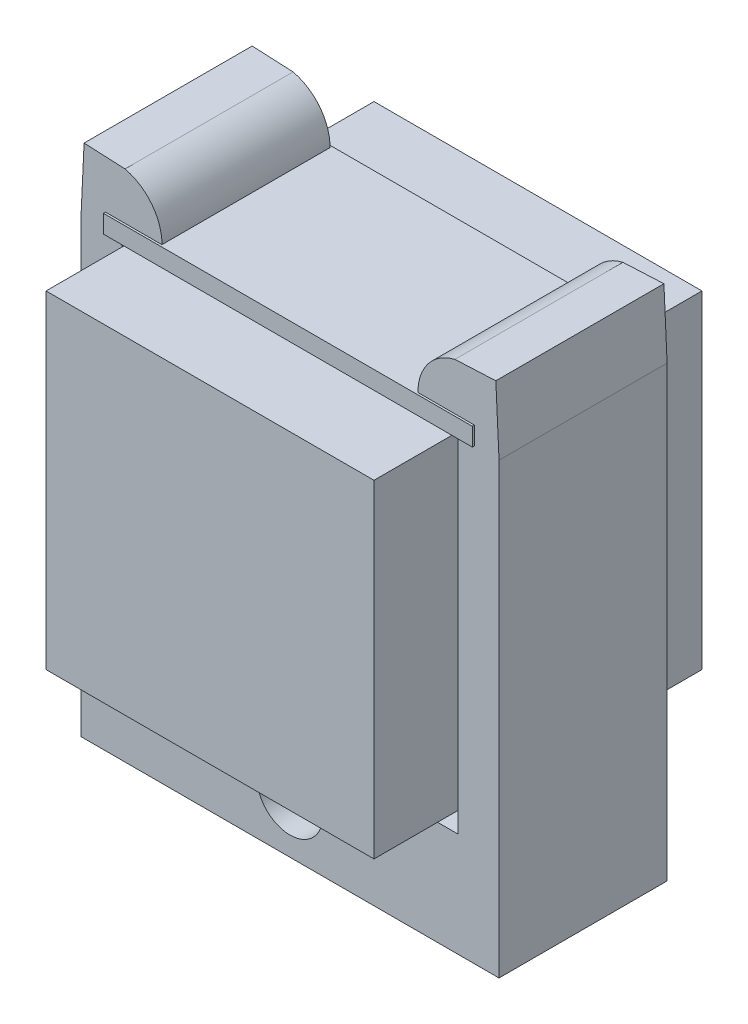
from build123d import *

# Parameters (mm, degrees)
SKETCH1_W                            = 45
SKETCH1_H                            = 21
BOSS_EXTRUDE1_DEPTH                  = 2.2
SKETCH2_W                            = 40
SKETCH2_H                            = 40
BOSS_EXTRUDE2_DEPTH                  = 40
SKETCH3_W                            = 41
SKETCH3_H                            = 12.7
SKETCH3_R                            = 4
SNAPFIT_41MM_SPACING_5MM_WIDTH_DEPTH = 10.25


with BuildPart() as part:
    # Sketch1 → Boss-Extrude1 (new body)
    with BuildSketch(Plane(origin=(0, 0, 0), x_dir=(1, 0, 0), z_dir=(0, 1, 0))):
        Rectangle(SKETCH1_W, SKETCH1_H)
    extrude(amount=BOSS_EXTRUDE1_DEPTH)


with BuildPart() as body_2:
    # Sketch2 → Boss-Extrude2 (new body)
    with BuildSketch(Plane(origin=(0, 0, 0), x_dir=(1, 0, 0), z_dir=(0, 1, 0))):
        Rectangle(SKETCH2_W, SKETCH2_H)
    extrude(amount=-BOSS_EXTRUDE2_DEPTH)


with BuildPart() as body_3:
    # Sketch3 → SnapFit-41mm_spacing-5mm_width (new, symmetric)
    # profile 1 of 3: a face of its own
    with BuildSketch(Plane.XY):
        with Locations((0, -48.35)):
            Rectangle(SKETCH3_W, SKETCH3_H)
        with Locations((0, -48.35)):
            Circle(SKETCH3_R, mode=Mode.SUBTRACT)
    # profile 2 of 3: a face of its own
    with BuildSketch(Plane.XY):
        with BuildLine():
            Line((-25.5, -54.7), (-20.5, -54.7))
            Line((-20.5, -54.7), (-20.5, -42))
            Line((-20.5, -42), (-20.5, 0))
            Line((-20.5, 0), (-20.395356671, 2.197509903))
            Line((-20.395356671, 2.197509903), (-15.615625086, 1.969903637))
            ThreePointArc((-15.615625086, 1.969903637), (-16.786428524, 5.773096985), (-20.115625086, 7.952892982))
            Line((-20.115625086, 7.952892982), (-25.109965775, 8.190718729))
            Line((-25.109965775, 8.190718729), (-25.5, 0))
            Line((-25.5, 0), (-25.5, -54.7))
        make_face()
    # profile 3 of 3: a face of its own
    with BuildSketch(Plane.XY):
        with BuildLine():
            Line((20.5, -42), (20.5, -54.7))
            Line((20.5, -54.7), (25.5, -54.7))
            Line((25.5, -54.7), (25.5, 0))
            Line((25.5, 0), (25.109965775, 8.190718729))
            Line((25.109965775, 8.190718729), (20.115625086, 7.952892982))
            ThreePointArc((20.115625086, 7.952892982), (16.786428524, 5.773096985), (15.615625086, 1.969903637))
            Line((15.615625086, 1.969903637), (20.395356671, 2.197509903))
            Line((20.395356671, 2.197509903), (20.5, 0))
            Line((20.5, 0), (20.5, -42))
        make_face()
    extrude(amount=SNAPFIT_41MM_SPACING_5MM_WIDTH_DEPTH, both=True)


solid = Compound([part.part, body_2.part, body_3.part])
